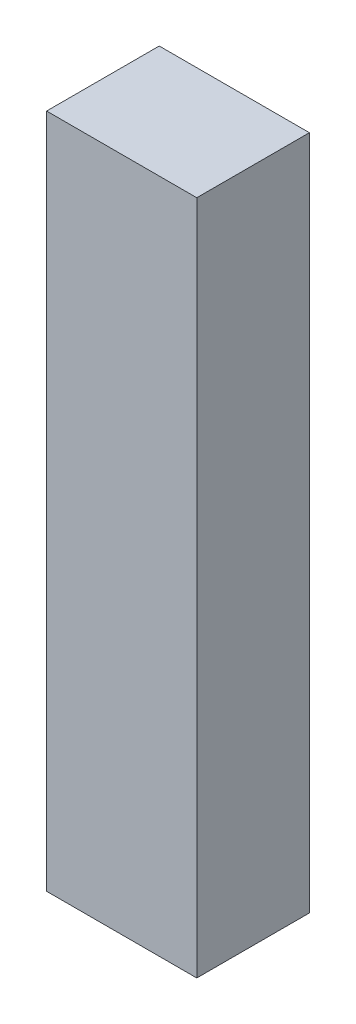
from build123d import *

# Parameters (mm, degrees)
SKETCH1_W           = 100
SKETCH1_H           = 75
BOSS_EXTRUDE1_DEPTH = 450


with BuildPart() as part:
    # Sketch1 → Boss-Extrude1 (new body)
    with BuildSketch(Plane(origin=(0, 0, 0), x_dir=(1, 0, 0), z_dir=(0, 1, 0))):
        Rectangle(SKETCH1_W, SKETCH1_H)
    extrude(amount=BOSS_EXTRUDE1_DEPTH)


solid = part.part
